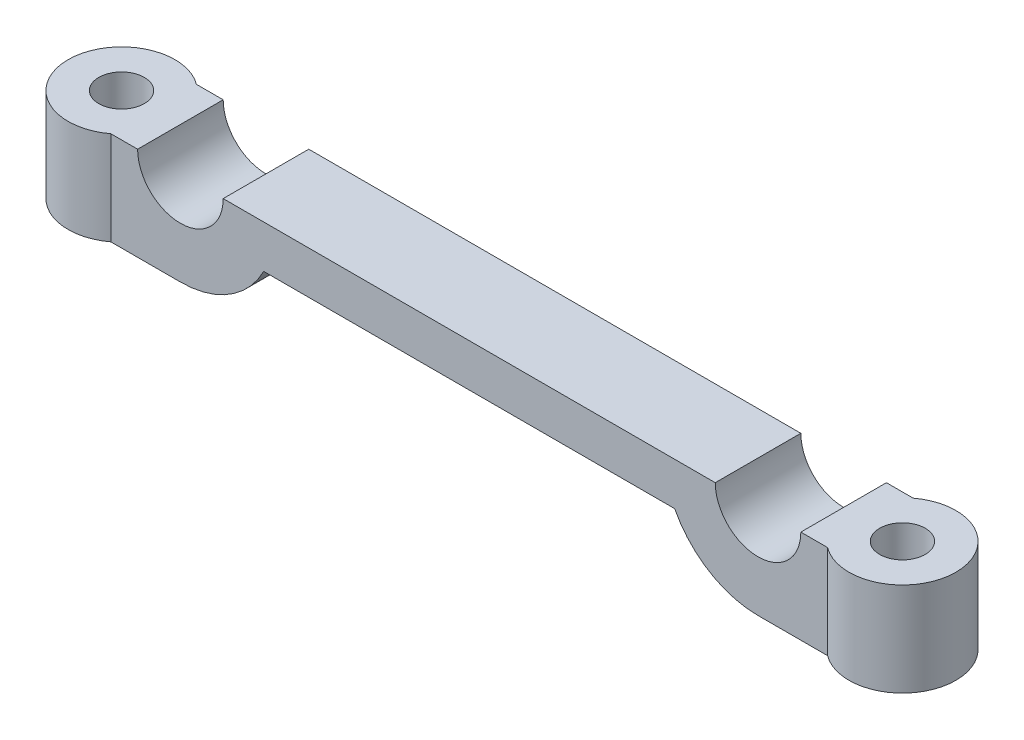
from build123d import *

# Parameters (mm, degrees)
BOSS_EXTRUDE1_DEPTH     = 13.89888
CUT_EXTRUDE1_DEPTH      = 69.830593656
CUT_EXTRUDE1_DEPTH_BACK = 69.830593656
CUT_EXTRUDE2_DEPTH      = 69.830593656
F_1_4_CLEARANCE_HOLE1_D = 6.7564


with BuildPart() as part:
    # Sketch1 → Boss-Extrude1 (new body)
    with BuildSketch(Plane(origin=(0, 0, 0), x_dir=(1, 0, 0), z_dir=(0, 1, 0))):
        with BuildLine():
            Line((-53.18125, 6.35), (53.18125, 6.35))
            ThreePointArc((53.18125, 6.35), (65.88125, 0), (53.18125, -6.35))
            Line((53.18125, -6.35), (-53.18125, -6.35))
            ThreePointArc((-53.18125, -6.35), (-65.88125, 0), (-53.18125, 6.35))
        make_face()
    extrude(amount=BOSS_EXTRUDE1_DEPTH)

    # Sketch2 → Cut-Extrude1 (cut, two sides: drawn at the far end of the back side and taken through both)
    with BuildSketch(Plane.XY.offset(6.35).offset(-CUT_EXTRUDE1_DEPTH_BACK)):
        with BuildLine():
            Line((-49.2125, 13.89888), (-36.5125, 13.89888))
            ThreePointArc((-36.5125, 13.89888), (-42.8625, 7.54888), (-49.2125, 13.89888))
        make_face()
        with BuildLine():
            Line((36.5125, 13.89888), (49.2125, 13.89888))
            ThreePointArc((49.2125, 13.89888), (42.8625, 7.54888), (36.5125, 13.89888))
        make_face()
    extrude(amount=CUT_EXTRUDE1_DEPTH + CUT_EXTRUDE1_DEPTH_BACK, mode=Mode.SUBTRACT)

    # Sketch3 → Cut-Extrude2 (cut, through all)
    with BuildSketch(Plane(origin=(0, 0, -6.35), x_dir=(-1, 0, 0), z_dir=(0, 0, -1))):
        with BuildLine():
            Line((30.498990577, 7.54888), (-30.498990577, 7.54888))
            ThreePointArc((-30.498990577, 7.54888), (-35.619538684, 2.036402323), (-42.8625, 0))
            Line((-42.8625, 0), (42.8625, 0))
            ThreePointArc((42.8625, 0), (35.619538684, 2.036402323), (30.498990577, 7.54888))
        make_face()
    extrude(amount=-CUT_EXTRUDE2_DEPTH, mode=Mode.SUBTRACT)

    # 1/4 Clearance Hole1 (through all)
    with Locations(Plane(origin=(0, 0, 0), x_dir=(-1, 0, 0), z_dir=(0, -1, 0))):
        with Locations((57.94375, 0), (-57.94375, 0)):
            Hole(F_1_4_CLEARANCE_HOLE1_D / 2)


solid = part.part
